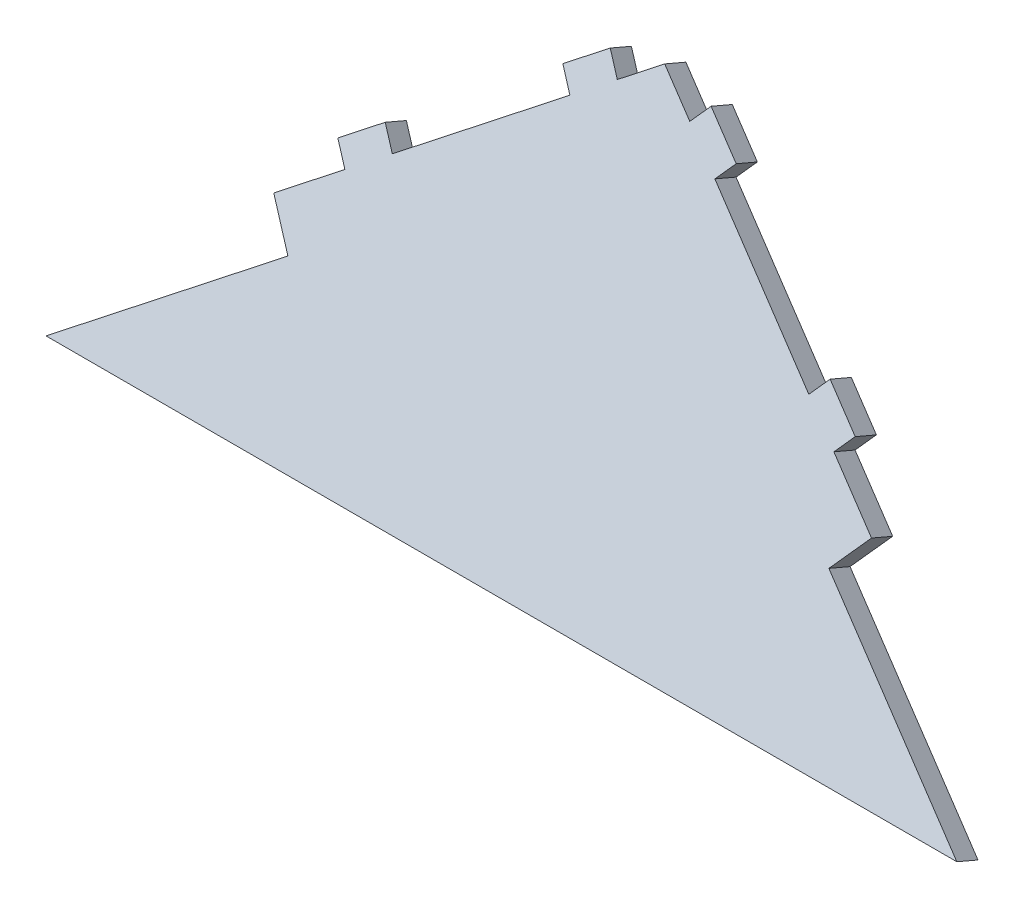
from build123d import *

# Parameters (mm, degrees)
BOSS_EXTRU_2_DEPTH = 5


with BuildPart() as part:
    # Esquisse3D1 → Boss.-Extru.2 (new body)
    with BuildSketch(Plane(origin=(0, 0, -20), x_dir=(0.7390861395742666, -0.6192967529535458, 0.2649966227528242), z_dir=(0, -0.3933971568972805, -0.9193686295198116))):
        Polygon((0, 0), (-1.66621979, 9.860208497), (-6.596324039, 9.027098602), (-8.262543829, 18.887307099), (-3.332439581, 19.720416995), (-9.574450906, 56.658841007), (-14.504555155, 55.825731112), (-16.170774945, 65.685939609), (-11.240670697, 66.519049504), (-13.740000382, 81.30936225), (-3.879791885, 82.97558204), (-12.381743978, 133.287684178), (133.861549138, 0), (82.978733138, 3.811803622), (82.231692627, -6.160253863), (67.2736064, -5.039693097), (66.900086145, -10.025721839), (56.928028661, -9.278681329), (57.301548916, -4.292652586), (19.944114969, -1.494081021), (19.570594714, -6.480109763), (9.598537229, -5.733069253), (9.972057485, -0.74704051), align=None)
    extrude(amount=BOSS_EXTRU_2_DEPTH)


solid = part.part
